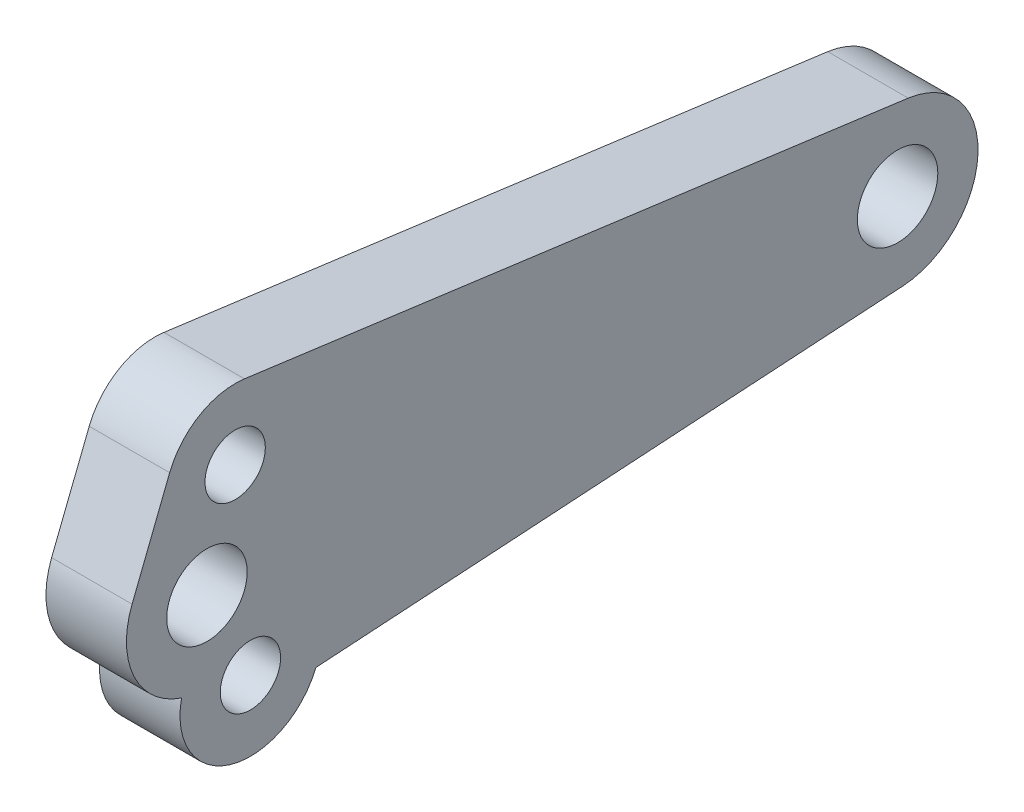
from build123d import *

# Parameters (mm, degrees)
SKETCH1_R           = 1
SKETCH1_R_2         = 0.75
BOSS_EXTRUDE1_DEPTH = 2


with BuildPart() as part:
    # Sketch1 → Boss-Extrude1 (new body)
    with BuildSketch(Plane(origin=(0, 0, 0), x_dir=(0, 0, -1), z_dir=(1, 0, 0))):
        with BuildLine():
            Line((2.706030377, -2.911399365), (17.287509609, -1.996071114))
            ThreePointArc((17.287509609, -1.996071114), (19.160976512, -0.070218298), (17.427275011, 1.982357258))
            Line((17.427275011, 1.982357258), (0.933331362, 4.187799716))
            ThreePointArc((0.933331362, 4.187799716), (-0.184232683, 3.962593396), (-0.925951299, 3.096844717))
            Line((-0.925951299, 3.096844717), (-1.859829004, 0.735551545))
            ThreePointArc((-1.859829004, 0.735551545), (-1.812327837, -0.845853303), (-0.63071828, -1.897944797))
            ThreePointArc((-0.63071828, -1.897944797), (0.572431558, -3.93640053), (2.706030377, -2.911399365))
        make_face()
        Circle(SKETCH1_R, mode=Mode.SUBTRACT)
        with Locations((17.162209545, 0)):
            Circle(SKETCH1_R, mode=Mode.SUBTRACT)
        with Locations((0.701399079, 2.453237115)):
            Circle(SKETCH1_R_2, mode=Mode.SUBTRACT)
        with Locations((1.081010079, -2.261931096)):
            Circle(SKETCH1_R_2, mode=Mode.SUBTRACT)
    extrude(amount=BOSS_EXTRUDE1_DEPTH)


solid = part.part
